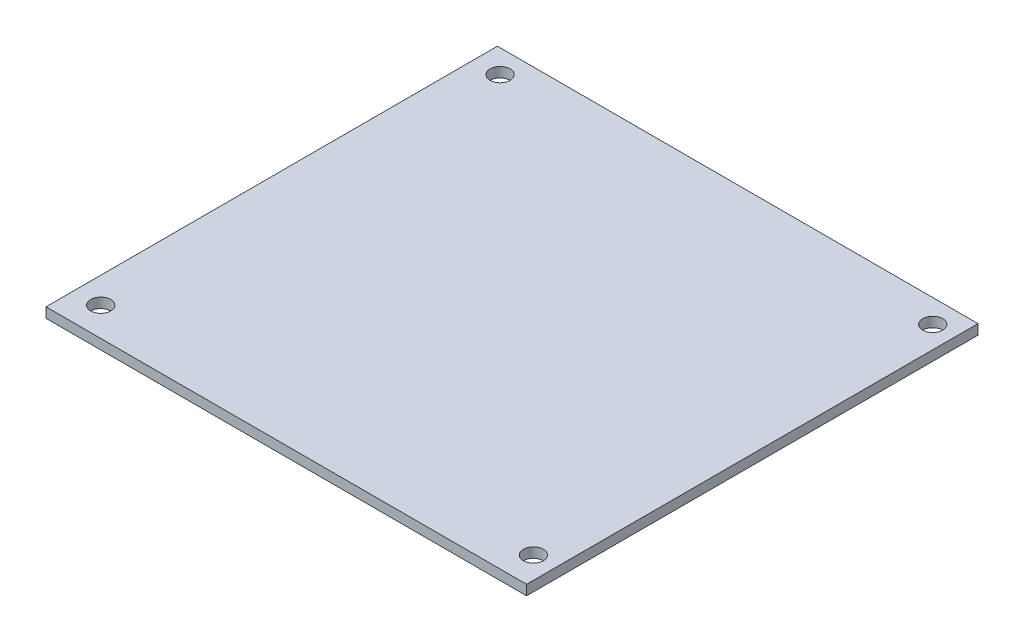
from build123d import *

# Parameters (mm, degrees)
ESQUISSE1_W        = 72.2
ESQUISSE1_H        = 67.82
ESQUISSE1_R        = 1.5
BOSS_EXTRU_1_DEPTH = 1.5
ESQUISSE1_4_W      = 72.2
ESQUISSE1_4_H      = 67.82
ESQUISSE1_4_R      = 1.5
ESQUISSE1_4_W_2    = 60
ESQUISSE1_4_H_2    = 30
BOSS_EXTRU_2_DEPTH = 1.5


with BuildPart() as part:
    # Esquisse1 → Boss.-Extru.1 (new body)
    with BuildSketch(Plane(origin=(0, 0, 0), x_dir=(1, 0, 0), z_dir=(0, 1, 0))):
        Rectangle(ESQUISSE1_W, ESQUISSE1_H)
        with Locations((-32.2, 30.41)):
            Circle(ESQUISSE1_R, mode=Mode.SUBTRACT)
        with Locations((32.8, 30.41)):
            Circle(ESQUISSE1_R, mode=Mode.SUBTRACT)
        with Locations((-32.2, -29.59)):
            Circle(ESQUISSE1_R, mode=Mode.SUBTRACT)
        with Locations((32.8, -29.59)):
            Circle(ESQUISSE1_R, mode=Mode.SUBTRACT)
    extrude(amount=BOSS_EXTRU_1_DEPTH)

    # Esquisse1<4> → Boss.-Extru.2 (add)
    with BuildSketch(Plane(origin=(0, 0, 0), x_dir=(1, 0, 0), z_dir=(0, 1, 0))):
        Rectangle(ESQUISSE1_4_W, ESQUISSE1_4_H)
        with Locations((-32.2, 30.41)):
            Circle(ESQUISSE1_4_R, mode=Mode.SUBTRACT)
        with Locations((32.8, 30.41)):
            Circle(ESQUISSE1_4_R, mode=Mode.SUBTRACT)
        with Locations((-32.2, -29.59)):
            Circle(ESQUISSE1_4_R, mode=Mode.SUBTRACT)
        with Locations((32.8, -29.59)):
            Circle(ESQUISSE1_4_R, mode=Mode.SUBTRACT)
        with Locations((-0.3, 3.91)):
            Rectangle(ESQUISSE1_4_W_2, ESQUISSE1_4_H_2, mode=Mode.SUBTRACT)
    extrude(amount=BOSS_EXTRU_2_DEPTH)


solid = part.part
